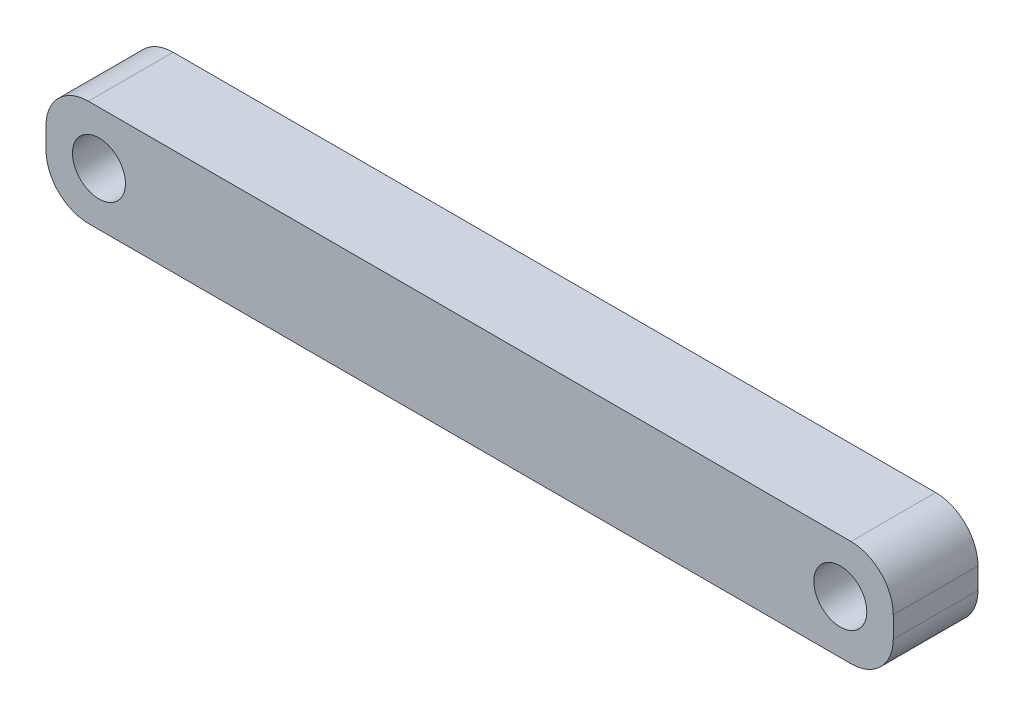
from build123d import *

# Parameters (mm, degrees)
SKETCH1_W           = 80
SKETCH1_H           = 10
SKETCH1_R           = 2.5
BOSS_EXTRUDE1_DEPTH = 8
FILLET1_R           = 4


with BuildPart() as part:
    # Sketch1 → Boss-Extrude1 (new body)
    with BuildSketch(Plane.XY):
        Rectangle(SKETCH1_W, SKETCH1_H)
        with Locations((-35, 0)):
            Circle(SKETCH1_R, mode=Mode.SUBTRACT)
        with Locations((35, 0)):
            Circle(SKETCH1_R, mode=Mode.SUBTRACT)
    extrude(amount=BOSS_EXTRUDE1_DEPTH)

    # Fillet1
    fillet1_edges = [part.edges().sort_by_distance(p)[0] for p in [
        (40, -5, 4),
        (-40, -5, 4),
        (-40, 5, 4),
        (40, 5, 4),
    ]]
    fillet(fillet1_edges, radius=FILLET1_R)


solid = part.part
